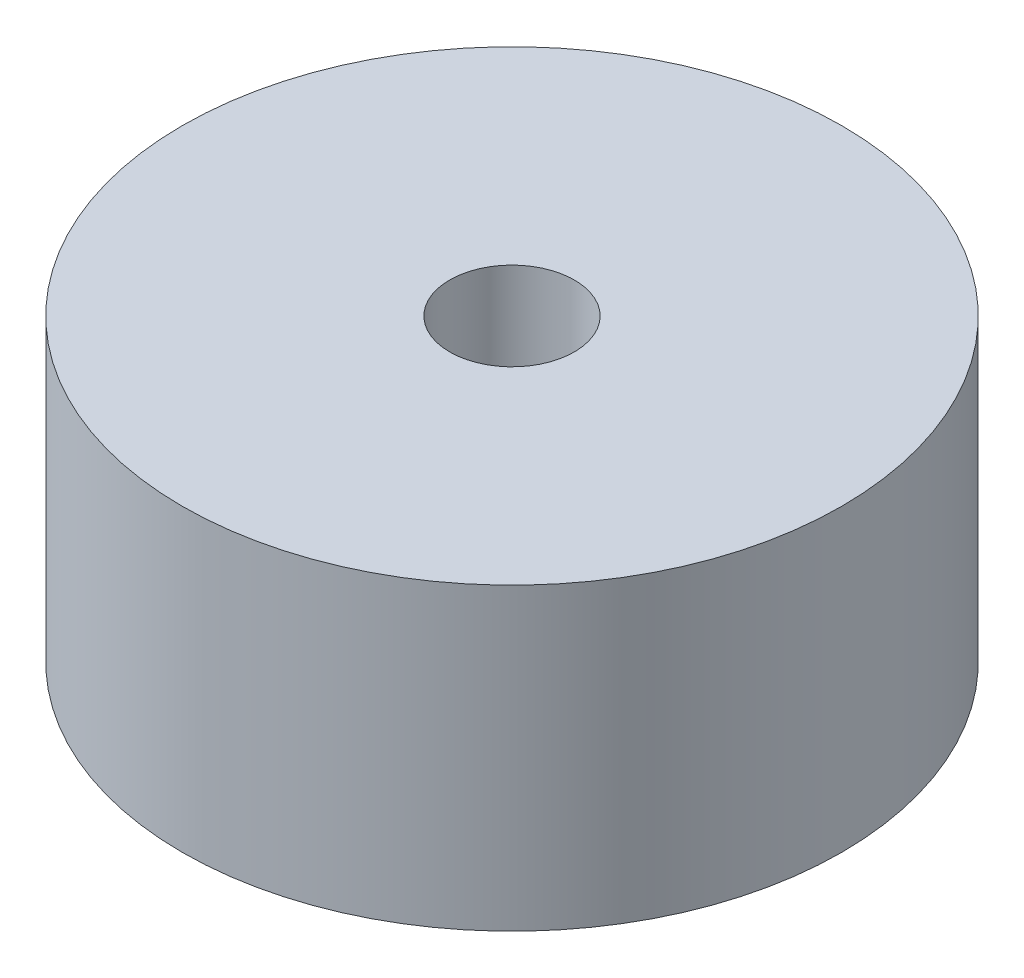
from build123d import *

# Parameters (mm, degrees)
SKETCH1_R           = 5.5
SKETCH1_R_2         = 1.04
BOSS_EXTRUDE1_DEPTH = 5


with BuildPart() as part:
    # Sketch1 → Boss-Extrude1 (new body)
    with BuildSketch(Plane(origin=(0, 0, 0), x_dir=(1, 0, 0), z_dir=(0, 1, 0))):
        with Locations(Location((0, 0, 0), (0, 0, 270))):
            Circle(SKETCH1_R)
        with Locations(Location((0, 0, 0), (0, 0, 270))):
            Circle(SKETCH1_R_2, mode=Mode.SUBTRACT)
    extrude(amount=BOSS_EXTRUDE1_DEPTH)


solid = part.part
